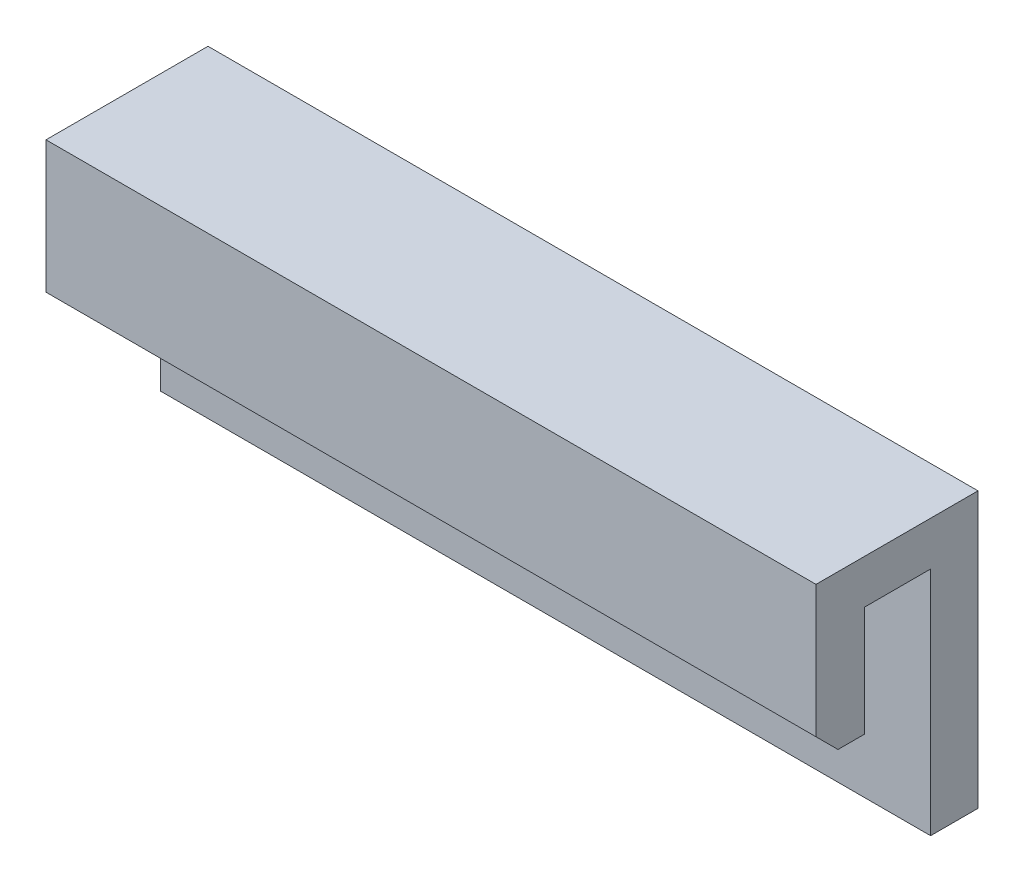
from build123d import *

# Parameters (mm, degrees)
BOSS_EXTRUDE1_DEPTH = 70
CHAMFER1_SIZE       = 2


with BuildPart() as part:
    # Sketch1 → Boss-Extrude1 (new body)
    with BuildSketch(Plane(origin=(0, 0, 0), x_dir=(0, 0, -1), z_dir=(1, 0, 0))):
        Polygon((-7.2, 6.018181818), (7.527272727, 6.018181818), (7.527272727, -10.381818182), (7.527272727, -18.981818182), (3.218181818, -18.981818182), (3.218181818, -7.981818182), (3.218181818, 2.018181818), (-2.781818182, 2.018181818), (-2.781818182, -7.981818182), (-7.2, -7.981818182), align=None)
    extrude(amount=BOSS_EXTRUDE1_DEPTH)

    # Chamfer1
    chamfer1_edges = [part.edges().sort_by_distance(p)[0] for p in [
        (35, -7.981818182, 7.2),
    ]]
    chamfer(chamfer1_edges, length=CHAMFER1_SIZE)


solid = part.part
